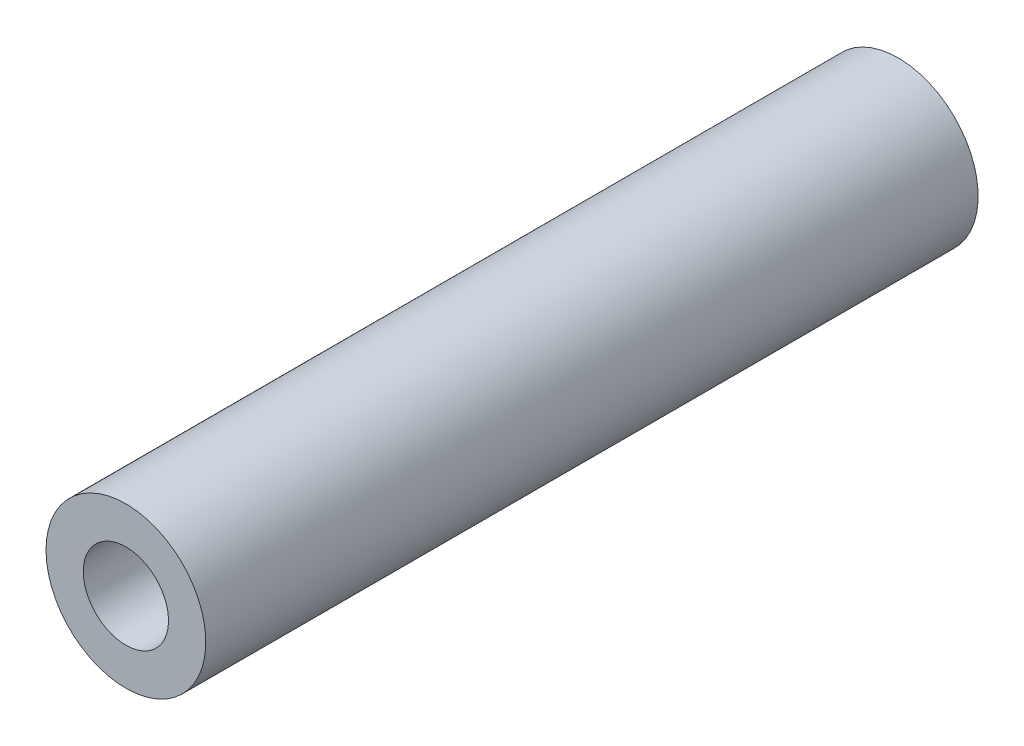
from build123d import *

# Parameters (mm, degrees)
SKETCH1_R    = 6
SKETCH1_R_2  = 3.2
SPACER_DEPTH = 58


with BuildPart() as part:
    # Sketch1 → Spacer (new body)
    with BuildSketch(Plane.XY):
        with Locations(Location((0, 0, 0), (0, 0, 180))):
            Circle(SKETCH1_R)
        with Locations(Location((0, 0, 0), (0, 0, 180))):
            Circle(SKETCH1_R_2, mode=Mode.SUBTRACT)
    extrude(amount=SPACER_DEPTH)


solid = part.part
